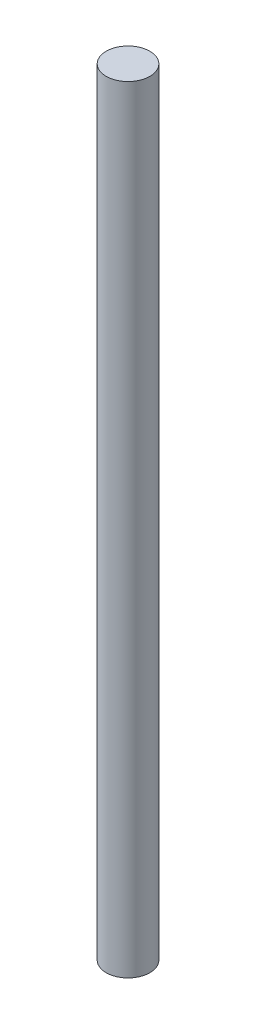
from build123d import *

# Parameters (mm, degrees)
SKETCH1_R           = 3.175
BOSS_EXTRUDE1_DEPTH = 113.03


with BuildPart() as part:
    # Sketch1 → Boss-Extrude1 (new body)
    with BuildSketch(Plane(origin=(0, 0, 0), x_dir=(1, 0, 0), z_dir=(0, 1, 0))):
        with Locations(Location((0, 0, 0), (0, 0, 90))):
            Circle(SKETCH1_R)
    extrude(amount=BOSS_EXTRUDE1_DEPTH)


solid = part.part
